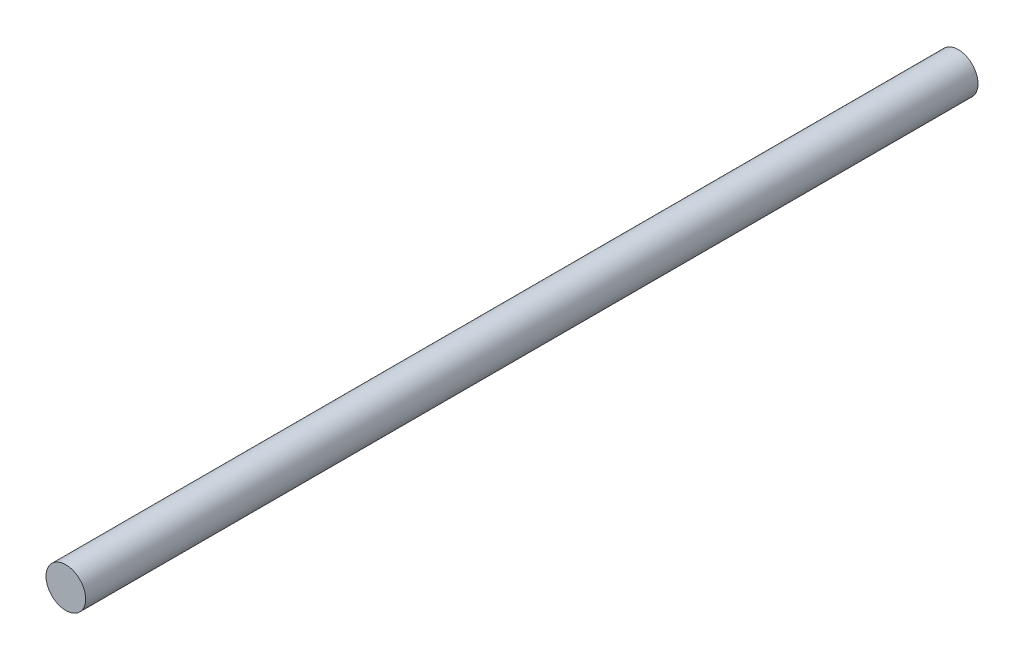
from build123d import *

# Parameters (mm, degrees)
ESBO_O1_R                = 4
RESSALTO_EXTRUS_O1_DEPTH = 90


with BuildPart() as part:
    # Esboço1 → Ressalto-extrusão1 (new, symmetric)
    with BuildSketch(Plane.XY):
        with Locations(Location((0, 0, 0), (0, 0, 180))):
            Circle(ESBO_O1_R)
    extrude(amount=RESSALTO_EXTRUS_O1_DEPTH, both=True)


solid = part.part
